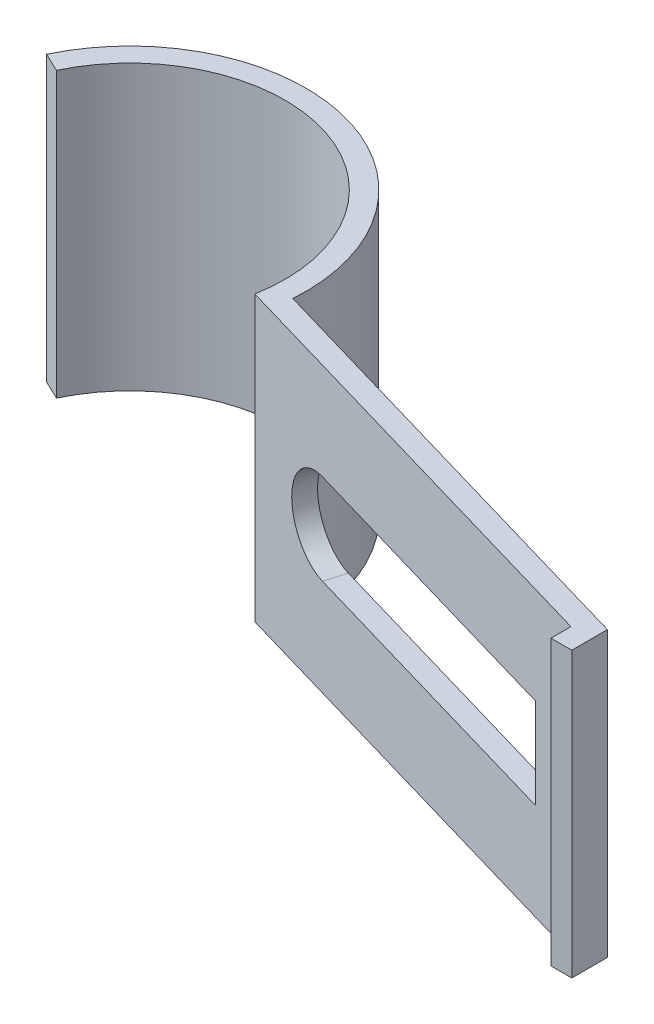
from build123d import *

# Parameters (mm, degrees)
BOSS_EXTRUDE1_DEPTH = 4.08
CUT_EXTRUDE1_DEPTH  = 0.3


with BuildPart() as part:
    # Sketch1 → Boss-Extrude1 (new body)
    with BuildSketch(Plane(origin=(0, 0, 0), x_dir=(1, 0, 0), z_dir=(0, 1, 0))):
        with BuildLine():
            Line((0.15, 0), (0.15, 0.512520873))
            Line((0.15, 0.512520873), (-6.232557616, 2.372866767))
            ThreePointArc((-6.232557616, 2.372866767), (-8.110196222, 5.002527571), (-11.041610225, 3.643316544))
            Line((-11.041610225, 3.643316544), (-10.770722466, 3.514398655))
            ThreePointArc((-10.770722466, 3.514398655), (-8.071596063, 4.67869548), (-6.561988987, 2.156403483))
            Line((-6.561988987, 2.156403483), (-0.15, 0.287479127))
            Line((-0.15, 0.287479127), (-0.15, 0))
            Line((-0.15, 0), (0.15, 0))
        make_face()
    extrude(amount=BOSS_EXTRUDE1_DEPTH)

    # Sketch2 → Cut-Extrude1 (cut)
    with BuildSketch(Plane(origin=(0.149434274, 0, -0.512685767), x_dir=(-0.9600498543859307, 0, -0.27982901403098553), z_dir=(0.27982901403098553, 0, -0.9600498543859307))):
        with BuildLine():
            Line((0.97346461, 1.39), (0.97346461, 2.69))
            Line((0.97346461, 2.69), (5.47346461, 2.69))
            ThreePointArc((5.47346461, 2.69), (6.12346461, 2.04), (5.47346461, 1.39))
            Line((5.47346461, 1.39), (0.97346461, 1.39))
        make_face()
    extrude(amount=-CUT_EXTRUDE1_DEPTH, mode=Mode.SUBTRACT)


solid = part.part
